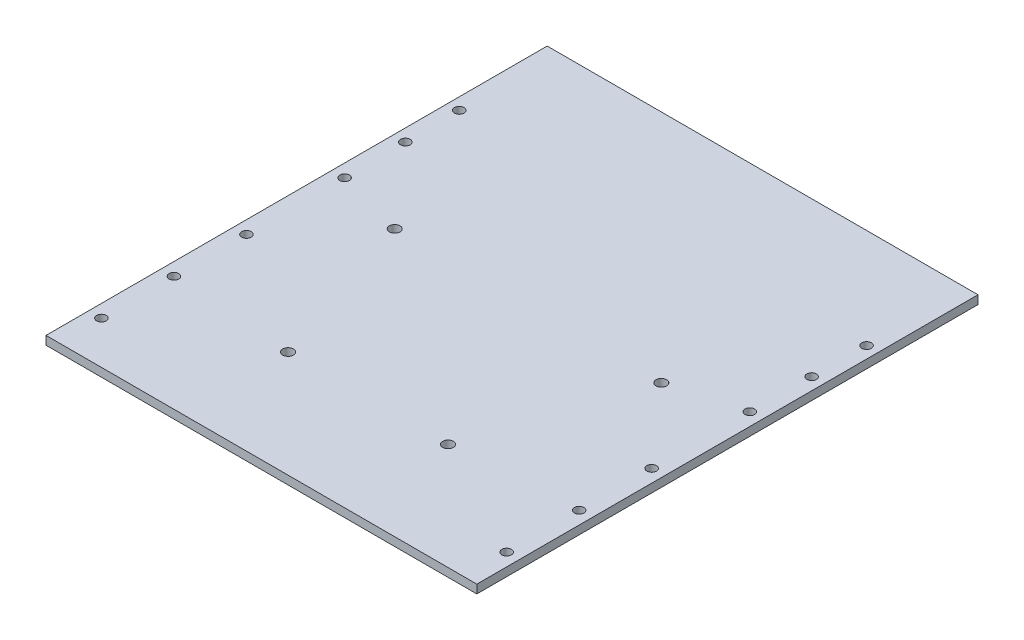
from build123d import *

# Parameters (mm, degrees)
SKETCH2_W           = 404
SKETCH2_H           = 470
BOSS_EXTRUDE1_DEPTH = 8
SKETCH3_R           = 4.5
SKETCH3_R_2         = 5
CUT_EXTRUDE1_DEPTH  = 8


with BuildPart() as part:
    # Sketch2 → Boss-Extrude1 (new body)
    with BuildSketch(Plane(origin=(0, 0, 0), x_dir=(1, 0, 0), z_dir=(0, 1, 0))):
        with Locations((202, 235)):
            Rectangle(SKETCH2_W, SKETCH2_H)
    extrude(amount=BOSS_EXTRUDE1_DEPTH)

    # Sketch3 → Cut-Extrude1 (cut)
    with BuildSketch(Plane(origin=(0, 8, 0), x_dir=(1, 0, 0), z_dir=(0, 1, 0))):
        with Locations(Location((12, 40, 0), (0, 0, 270))):
            Circle(SKETCH3_R)
        with Locations(Location((12, 108, 0), (0, 0, 270))):
            Circle(SKETCH3_R)
        with Locations(Location((12, 176, 0), (0, 0, 270))):
            Circle(SKETCH3_R)
        with Locations(Location((12, 268, 0), (0, 0, 270))):
            Circle(SKETCH3_R)
        with Locations(Location((11.5, 325.5, 0), (0, 0, 270))):
            Circle(SKETCH3_R)
        with Locations(Location((11, 376.5, 0), (0, 0, 270))):
            Circle(SKETCH3_R)
        with Locations(Location((392, 40, 0), (0, 0, 90))):
            Circle(SKETCH3_R)
        with Locations(Location((392, 108, 0), (0, 0, 90))):
            Circle(SKETCH3_R)
        with Locations(Location((392, 176, 0), (0, 0, 90))):
            Circle(SKETCH3_R)
        with Locations(Location((392, 268, 0), (0, 0, 90))):
            Circle(SKETCH3_R)
        with Locations(Location((392.5, 325.5, 0), (0, 0, 90))):
            Circle(SKETCH3_R)
        with Locations(Location((393, 376.5, 0), (0, 0, 90))):
            Circle(SKETCH3_R)
        with Locations(Location((127, 100, 0), (0, 0, 270))):
            Circle(SKETCH3_R_2)
        with Locations(Location((277, 100, 0), (0, 0, 270))):
            Circle(SKETCH3_R_2)
        with Locations(Location((77, 250, 0), (0, 0, 270))):
            Circle(SKETCH3_R_2)
        with Locations(Location((327, 250, 0), (0, 0, 270))):
            Circle(SKETCH3_R_2)
    extrude(amount=-CUT_EXTRUDE1_DEPTH, mode=Mode.SUBTRACT)


solid = part.part
